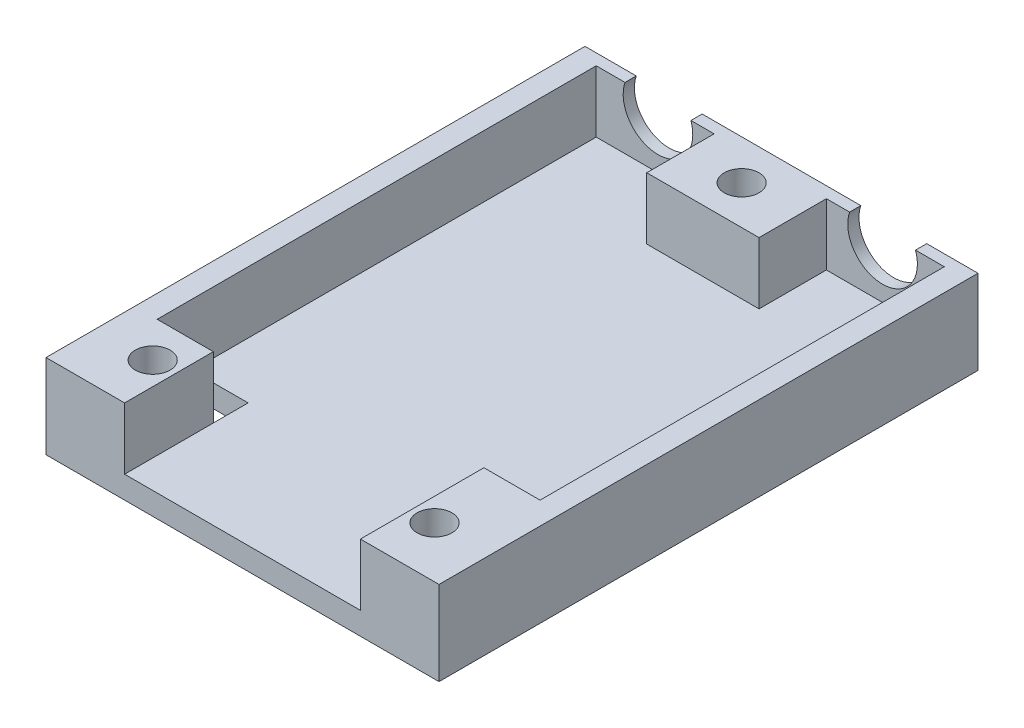
from build123d import *

# Parameters (mm, degrees)
SKETCH1_W           = 35
SKETCH1_H           = 48
BOSS_EXTRUDE1_DEPTH = 2
SKETCH2_W           = 35
SKETCH2_H           = 48
SKETCH2_W_2         = 31
SKETCH2_H_2         = 44
BOSS_EXTRUDE2_DEPTH = 5.5
SKETCH3_W           = 10
SKETCH3_H           = 6
SKETCH3_W_2         = 5
SKETCH3_H_2         = 8
BOSS_EXTRUDE3_DEPTH = 5.5
SKETCH4_W           = 21
SKETCH4_H           = 5.5
CUT_EXTRUDE1_DEPTH  = 3
SKETCH5_W           = 4.9
SKETCH5_H           = 4.9
BOSS_EXTRUDE4_DEPTH = 2
CUT_EXTRUDE2_DEPTH  = 2
CUT_EXTRUDE3_START  = -7.5
SKETCH7_W           = 5
SKETCH7_H           = 3.1
CUT_EXTRUDE3_DEPTH  = 7.5
CUT_EXTRUDE4_START  = 7.5
SKETCH8_R           = 1.55
CUT_EXTRUDE4_DEPTH  = 5.5


with BuildPart() as part:
    # Sketch1 → Boss-Extrude1 (new body)
    with BuildSketch(Plane(origin=(0, 0, 0), x_dir=(1, 0, 0), z_dir=(0, 1, 0))):
        Rectangle(SKETCH1_W, SKETCH1_H)
    extrude(amount=BOSS_EXTRUDE1_DEPTH)

    # Sketch2 → Boss-Extrude2 (add)
    with BuildSketch(Plane(origin=(0, 2, 0), x_dir=(1, 0, 0), z_dir=(0, 1, 0))):
        Rectangle(SKETCH2_W, SKETCH2_H)
        with Locations((0, 1)):
            Rectangle(SKETCH2_W_2, SKETCH2_H_2, mode=Mode.SUBTRACT)
    extrude(amount=BOSS_EXTRUDE2_DEPTH)

    # Sketch3 → Boss-Extrude3 (add)
    with BuildSketch(Plane(origin=(0, 2, 0), x_dir=(1, 0, 0), z_dir=(0, 1, 0))):
        with Locations((0, 20)):
            Rectangle(SKETCH3_W, SKETCH3_H)
        with Locations((-13, -17)):
            Rectangle(SKETCH3_W_2, SKETCH3_H_2)
        with Locations((13, -17)):
            Rectangle(SKETCH3_W_2, SKETCH3_H_2)
    extrude(amount=BOSS_EXTRUDE3_DEPTH)

    # Sketch4 → Cut-Extrude1 (cut)
    with BuildSketch(Plane.XY.offset(24)):
        with Locations((0, 4.75)):
            Rectangle(SKETCH4_W, SKETCH4_H)
    extrude(amount=-CUT_EXTRUDE1_DEPTH, mode=Mode.SUBTRACT)

    # Sketch5 → Boss-Extrude4 (add)
    with BuildSketch(Plane.XZ):
        with Locations((0, 6.05)):
            Rectangle(SKETCH5_W, SKETCH5_H)
        with Locations((0, -6.05)):
            Rectangle(SKETCH5_W, SKETCH5_H)
    extrude(amount=BOSS_EXTRUDE4_DEPTH)

    # Sketch6 → Cut-Extrude2 (cut)
    with BuildSketch(Plane(origin=(0, 0, -24), x_dir=(-1, 0, 0), z_dir=(0, 0, -1))):
        with BuildLine():
            ThreePointArc((-12.93428015, 7.5), (-10, 3.4), (-7.06571985, 7.5))
            Line((-7.06571985, 7.5), (-12.93428015, 7.5))
        make_face()
        with BuildLine():
            Line((12.93428015, 7.5), (7.06571985, 7.5))
            ThreePointArc((7.06571985, 7.5), (10, 3.4), (12.93428015, 7.5))
        make_face()
    extrude(amount=-CUT_EXTRUDE2_DEPTH, mode=Mode.SUBTRACT)

    # Sketch7 → Cut-Extrude3 (cut)
    with BuildSketch(Plane(origin=(0, 7.5, 0), x_dir=(1, 0, 0), z_dir=(0, 1, 0)).offset(CUT_EXTRUDE3_START)):
        with Locations((-13, -14.55)):
            Rectangle(SKETCH7_W, SKETCH7_H)
    extrude(amount=CUT_EXTRUDE3_DEPTH, mode=Mode.SUBTRACT)

    # Sketch8 → Cut-Extrude4 (cut)
    with BuildSketch(Plane(origin=(0, 0, 0), x_dir=(1, 0, 0), z_dir=(0, 1, 0)).offset(CUT_EXTRUDE4_START)):
        with Locations(Location((-12.55, -19.45, 0), (0, 0, 270))):
            Circle(SKETCH8_R)
        with Locations(Location((12.55, -19.45, 0), (0, 0, 270))):
            Circle(SKETCH8_R)
        with Locations(Location((0, 20.45, 0), (0, 0, 270))):
            Circle(SKETCH8_R)
    extrude(amount=-CUT_EXTRUDE4_DEPTH, mode=Mode.SUBTRACT)


solid = part.part
